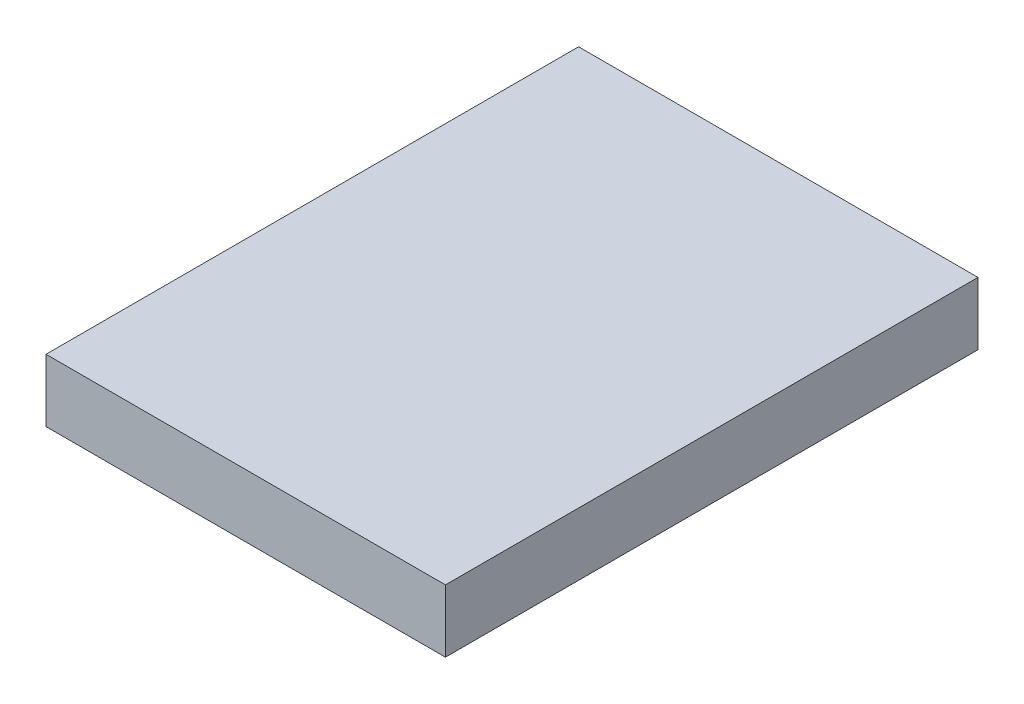
from build123d import *

# Parameters (mm, degrees)
SKETCH1_W           = 76.5
SKETCH1_H           = 12
BOSS_EXTRUDE1_DEPTH = 102


with BuildPart() as part:
    # Sketch1 → Boss-Extrude1 (new body)
    with BuildSketch(Plane.XY):
        Rectangle(SKETCH1_W, SKETCH1_H)
    extrude(amount=BOSS_EXTRUDE1_DEPTH)


solid = part.part
